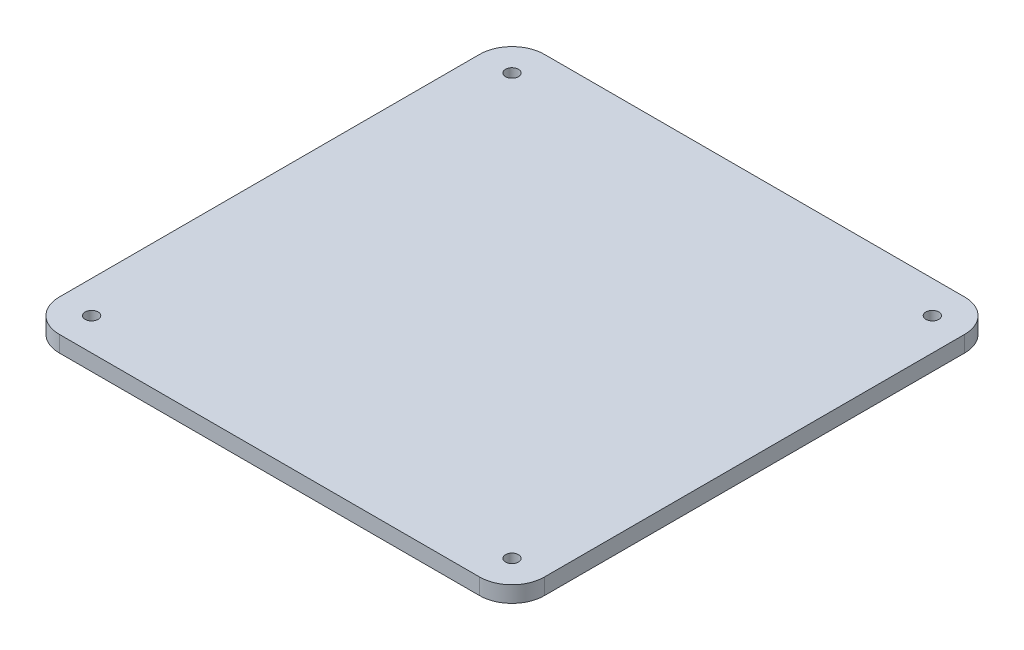
from build123d import *

# Parameters (mm, degrees)
SKETCH1_W           = 150
SKETCH1_H           = 150
BOSS_EXTRUDE1_DEPTH = 5
FILLET1_R           = 10
SKETCH2_R           = 2
CUT_EXTRUDE1_DEPTH  = 107.183802908


with BuildPart() as part:
    # Sketch1 → Boss-Extrude1 (new body)
    with BuildSketch(Plane(origin=(0, 0, 0), x_dir=(1, 0, 0), z_dir=(0, 1, 0))):
        Rectangle(SKETCH1_W, SKETCH1_H)
    extrude(amount=BOSS_EXTRUDE1_DEPTH)

    # Fillet1
    fillet1_edges = [part.edges().sort_by_distance(p)[0] for p in [
        (-75, 2.5, -75),
        (-75, 2.5, 75),
        (75, 2.5, 75),
        (75, 2.5, -75),
    ]]
    fillet(fillet1_edges, radius=FILLET1_R)

    # Sketch2 → Cut-Extrude1 (cut, through all)
    with BuildSketch(Plane(origin=(0, 5, 0), x_dir=(1, 0, 0), z_dir=(0, 1, 0))):
        with Locations(Location((65, 65, 0), (0, 0, 270))):
            Circle(SKETCH2_R)
        with Locations(Location((-65, 65, 0), (0, 0, 270))):
            Circle(SKETCH2_R)
        with Locations(Location((-65, -65, 0), (0, 0, 270))):
            Circle(SKETCH2_R)
        with Locations(Location((65, -65, 0), (0, 0, 270))):
            Circle(SKETCH2_R)
    extrude(amount=-CUT_EXTRUDE1_DEPTH, mode=Mode.SUBTRACT)


solid = part.part
